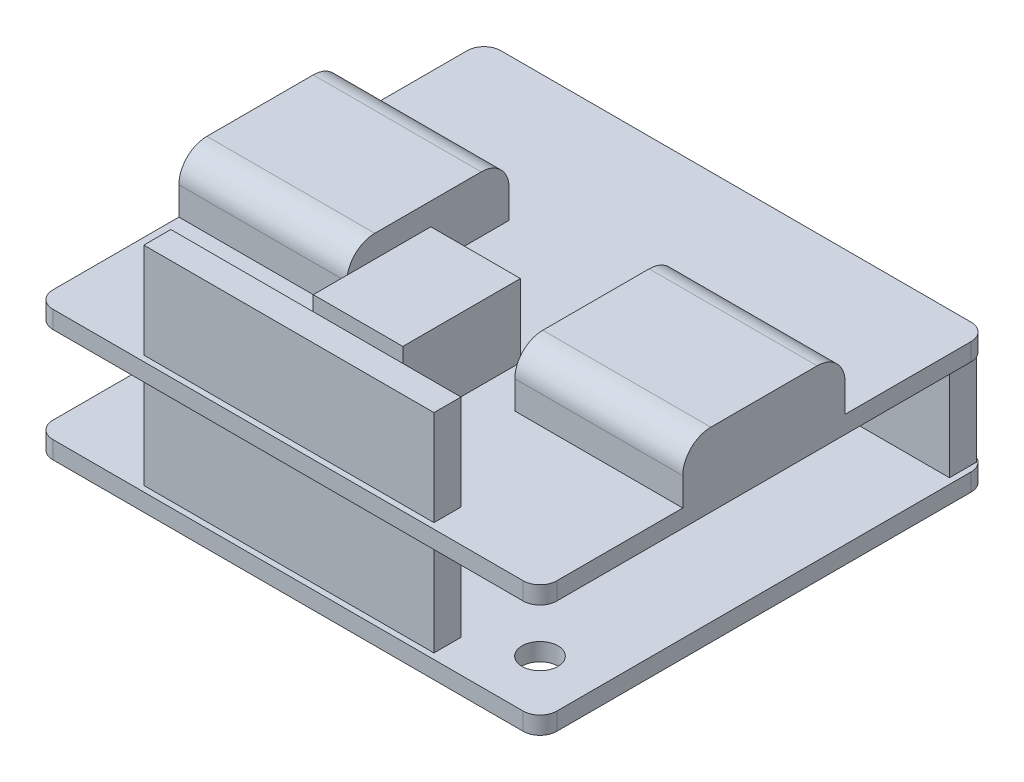
from build123d import *

# Parameters (mm, degrees)
SKETCH1_W            = 45
SKETCH1_H            = 40
BOSS_EXTRUDE1_DEPTH  = 1.57
SKETCH2_W            = 25.91
SKETCH2_H            = 2.41
BOSS_EXTRUDE2_DEPTH  = 8.51
SKETCH3_W            = 45
SKETCH3_H            = 40
BOSS_EXTRUDE3_DEPTH  = 1.57
SKETCH4_W            = 25.91
SKETCH4_H            = 2.41
BOSS_EXTRUDE4_DEPTH  = 8.51
SKETCH5_W            = 15
SKETCH5_H            = 14.5
BOSS_EXTRUDE5_DEPTH  = 5
FILLET1_R            = 2.5
FILLET1_OF_MIRROR1_R = 2.5
SKETCH6_W            = 8
SKETCH6_H            = 10.5
BOSS_EXTRUDE6_DEPTH  = 6.5
CUT_EXTRUDE1_REACH   = 37.381
SKETCH7_R            = 1.6
FILLET2_R            = 1.5
FILLET3_R            = 1.5


with BuildPart() as part:
    # Sketch1 → Boss-Extrude1 (new body)
    with BuildSketch(Plane(origin=(0, 0, 0), x_dir=(1, 0, 0), z_dir=(0, 1, 0))):
        Rectangle(SKETCH1_W, SKETCH1_H)
    extrude(amount=BOSS_EXTRUDE1_DEPTH)

    # Sketch2 → Boss-Extrude2 (add)
    with BuildSketch(Plane(origin=(0, 1.57, 0), x_dir=(1, 0, 0), z_dir=(0, 1, 0))):
        with Locations((9.035, 18.285)):
            Rectangle(SKETCH2_W, SKETCH2_H)
        with Locations((-0.435, -18.285)):
            Rectangle(SKETCH2_W, SKETCH2_H)
    extrude(amount=BOSS_EXTRUDE2_DEPTH)

    # Sketch3 → Boss-Extrude3 (add)
    with BuildSketch(Plane(origin=(0, 10.08, 0), x_dir=(1, 0, 0), z_dir=(0, 1, 0))):
        Rectangle(SKETCH3_W, SKETCH3_H)
    extrude(amount=BOSS_EXTRUDE3_DEPTH)

    # Sketch4 → Boss-Extrude4 (add)
    with BuildSketch(Plane(origin=(0, 11.65, 0), x_dir=(1, 0, 0), z_dir=(0, 1, 0))):
        with Locations((-0.435, -18.285)):
            Rectangle(SKETCH4_W, SKETCH4_H)
    extrude(amount=BOSS_EXTRUDE4_DEPTH)

    # Sketch5 → Boss-Extrude5 (add)
    with BuildSketch(Plane(origin=(0, 11.65, 0), x_dir=(1, 0, 0), z_dir=(0, 1, 0))):
        with Locations((-15, 0)):
            Rectangle(SKETCH5_W, SKETCH5_H)
    boss_extrude5 = extrude(amount=BOSS_EXTRUDE5_DEPTH)

    # Fillet1
    fillet1_edges = [part.edges().sort_by_distance(p)[0] for p in [
        (-15, 16.65, 7.25),
        (-15, 16.65, -7.25),
    ]]
    fillet(fillet1_edges, radius=FILLET1_R)

    # Mirror1: Boss-Extrude5 across plane
    add(boss_extrude5.mirror(Plane(origin=(0, 0, 0), x_dir=(0, 0, 1), z_dir=(1, 0, 0))))

    # Fillet1 of Mirror1
    fillet1_of_mirror1_edges = [part.edges().sort_by_distance(p)[0] for p in [
        (15, 16.65, 7.25),
        (15, 16.65, -7.25),
    ]]
    fillet(fillet1_of_mirror1_edges, radius=FILLET1_OF_MIRROR1_R)

    # Sketch6 → Boss-Extrude6 (add)
    with BuildSketch(Plane(origin=(0, 11.65, 0), x_dir=(1, 0, 0), z_dir=(0, 1, 0))):
        with Locations((0, -8.5)):
            Rectangle(SKETCH6_W, SKETCH6_H)
    extrude(amount=BOSS_EXTRUDE6_DEPTH)

    # Sketch7 → Cut-Extrude1 (cut, up to next)
    with BuildSketch(Plane(origin=(0, 1.57, 0), x_dir=(1, 0, 0), z_dir=(0, 1, 0)), mode=Mode.PRIVATE) as cut_extrude1_sk1:
        with Locations(Location((17.5, -15, 0), (0, 0, 270))):
            Circle(SKETCH7_R)
    cut_extrude1_tool1 = extrude(cut_extrude1_sk1.sketch, amount=-CUT_EXTRUDE1_REACH, mode=Mode.PRIVATE) & part.part
    # Sketch7 → Cut-Extrude1 (cut, up to next)
    with BuildSketch(Plane(origin=(0, 1.57, 0), x_dir=(1, 0, 0), z_dir=(0, 1, 0)), mode=Mode.PRIVATE) as cut_extrude1_sk2:
        with Locations(Location((-17.5, 15, 0), (0, 0, 270))):
            Circle(SKETCH7_R)
    cut_extrude1_tool2 = extrude(cut_extrude1_sk2.sketch, amount=-CUT_EXTRUDE1_REACH, mode=Mode.PRIVATE) & part.part
    add(cut_extrude1_tool1.solids().sort_by_distance((17.5, 1.57, 15))[0], mode=Mode.SUBTRACT)
    add(cut_extrude1_tool2.solids().sort_by_distance((-17.5, 1.57, -15))[0], mode=Mode.SUBTRACT)

    # Fillet2
    fillet2_edges = [part.edges().sort_by_distance(p)[0] for p in [
        (22.5, 0.785, 20),
        (-22.5, 0.785, 20),
        (-22.5, 0.785, -20),
        (22.5, 0.785, -20),
    ]]
    fillet(fillet2_edges, radius=FILLET2_R)

    # Fillet3
    fillet3_edges = [part.edges().sort_by_distance(p)[0] for p in [
        (22.5, 10.865, 20),
        (22.5, 10.865, -20),
        (-22.5, 10.865, -20),
        (-22.5, 10.865, 20),
    ]]
    fillet(fillet3_edges, radius=FILLET3_R)


solid = part.part
